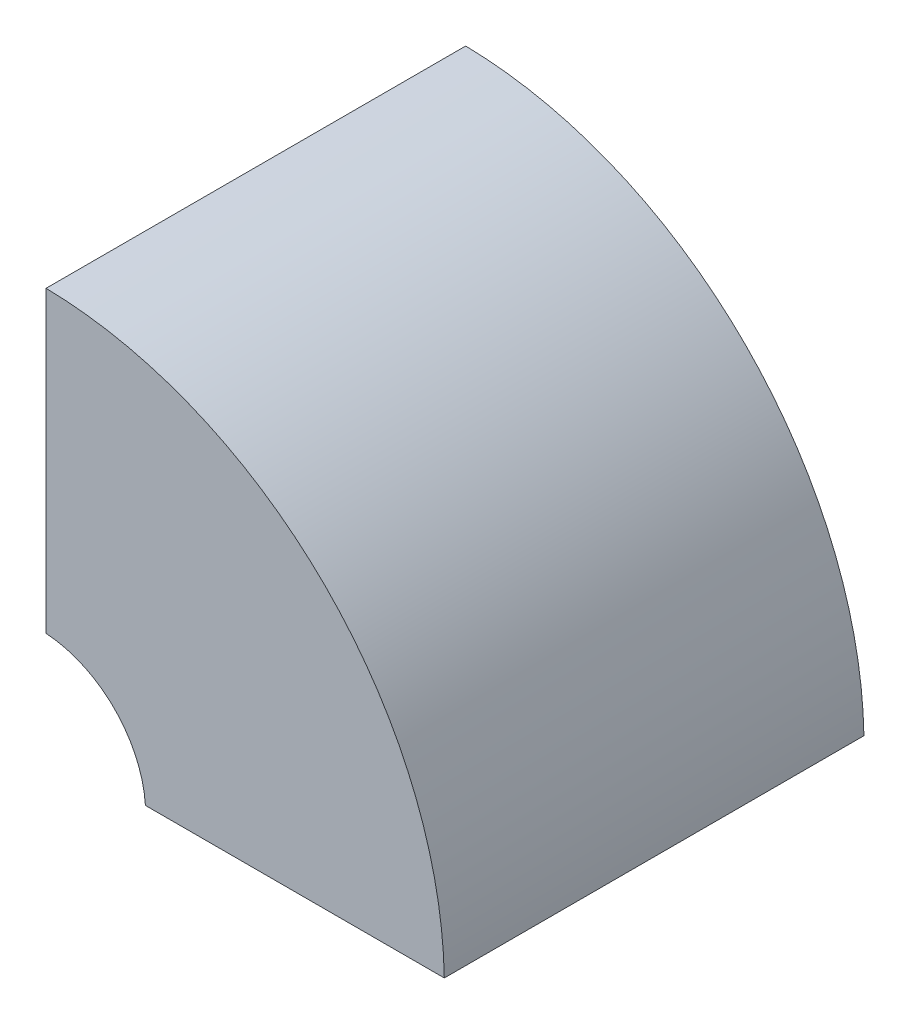
from build123d import *

# Parameters (mm, degrees)
BOSS_EXTRUDE1_DEPTH = 29.5


with BuildPart() as part:
    # Sketch1 → Boss-Extrude1 (new body)
    with BuildSketch(Plane.XY):
        with BuildLine():
            Line((0.5, 28.495613698), (0.5, 7.483314774))
            ThreePointArc((0.5, 7.483314774), (5.303300859, 5.303300859), (7.483314774, 0.5))
            Line((7.483314774, 0.5), (28.495613698, 0.5))
            ThreePointArc((28.495613698, 0.5), (20.152543264, 20.152543264), (0.5, 28.495613698))
        make_face()
    extrude(amount=-BOSS_EXTRUDE1_DEPTH)


solid = part.part
